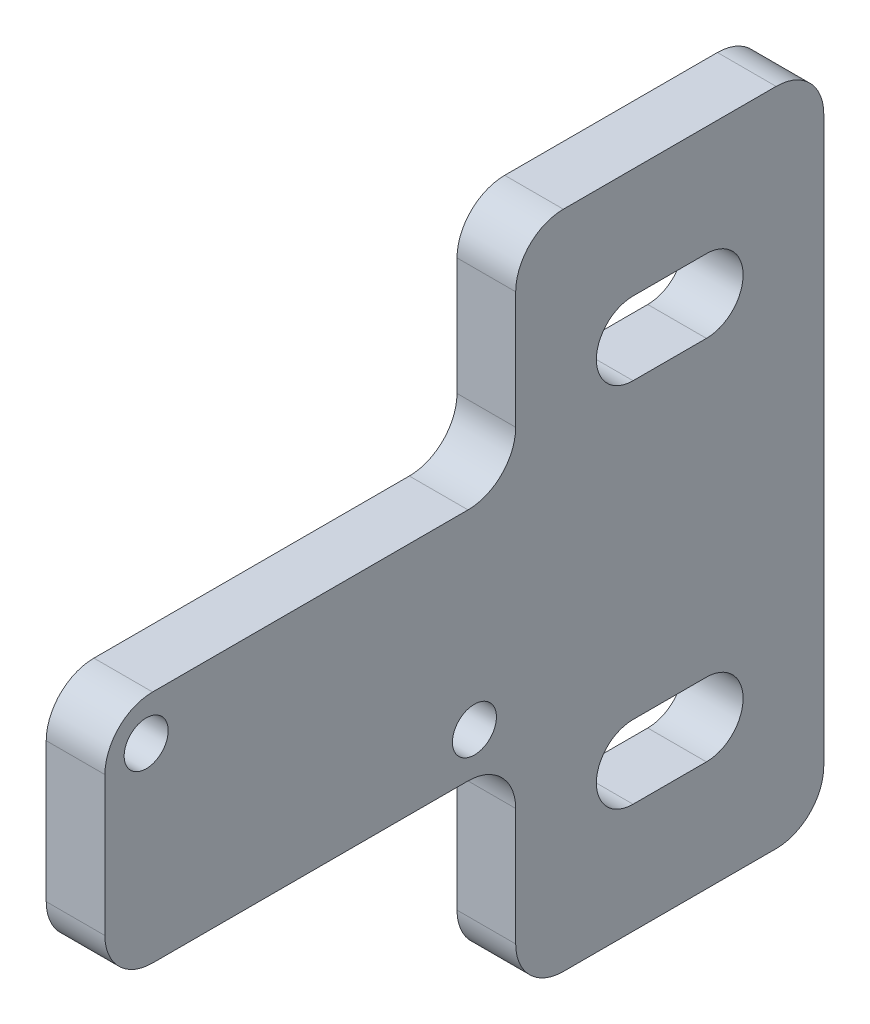
from build123d import *

# Parameters (mm, degrees)
SKETCH1_W           = 16
SKETCH1_H           = 28
SKETCH1_R           = 1.5
SKETCH1_W_2         = 45
SKETCH1_H_2         = 21
BOSS_EXTRUDE1_DEPTH = 4
FILLET1_R           = 3.25


with BuildPart() as part:
    # Sketch1 → Boss-Extrude1 (new body)
    # profile 1 of 2: a face of its own
    with BuildSketch(Plane.YZ):
        with Locations((8, 14)):
            Rectangle(SKETCH1_W, SKETCH1_H)
        with Locations(Location((13.187246979, 25.187246979, 0), (0, 0, 270))):
            Circle(SKETCH1_R, mode=Mode.SUBTRACT)
        with Locations(Location((2.812753021, 2.812753021, 0), (0, 0, 270))):
            Circle(SKETCH1_R, mode=Mode.SUBTRACT)
    # profile 2 of 2: a face of its own
    with BuildSketch(Plane.YZ):
        with Locations((8, -10.5)):
            Rectangle(SKETCH1_W_2, SKETCH1_H_2)
        with BuildLine():
            Line((-2, -8), (-2, -13))
            ThreePointArc((-2, -13), (-4.5, -15.5), (-7, -13))
            Line((-7, -13), (-7, -8))
            ThreePointArc((-7, -8), (-4.5, -5.5), (-2, -8))
        make_face(mode=Mode.SUBTRACT)
        with BuildLine():
            Line((23, -8), (23, -13))
            ThreePointArc((23, -13), (20.5, -15.5), (18, -13))
            Line((18, -13), (18, -8))
            ThreePointArc((18, -8), (20.5, -5.5), (23, -8))
        make_face(mode=Mode.SUBTRACT)
    extrude(amount=BOSS_EXTRUDE1_DEPTH)

    # Fillet1
    fillet1_edges = [part.edges().sort_by_distance(p)[0] for p in [
        (2, 0, 28),
        (2, 16, 28),
        (2, 16, 0),
        (2, 30.5, 0),
        (2, 30.5, -21),
        (2, -14.5, -21),
        (2, -14.5, 0),
        (2, 0, 0),
    ]]
    fillet(fillet1_edges, radius=FILLET1_R)


solid = part.part
